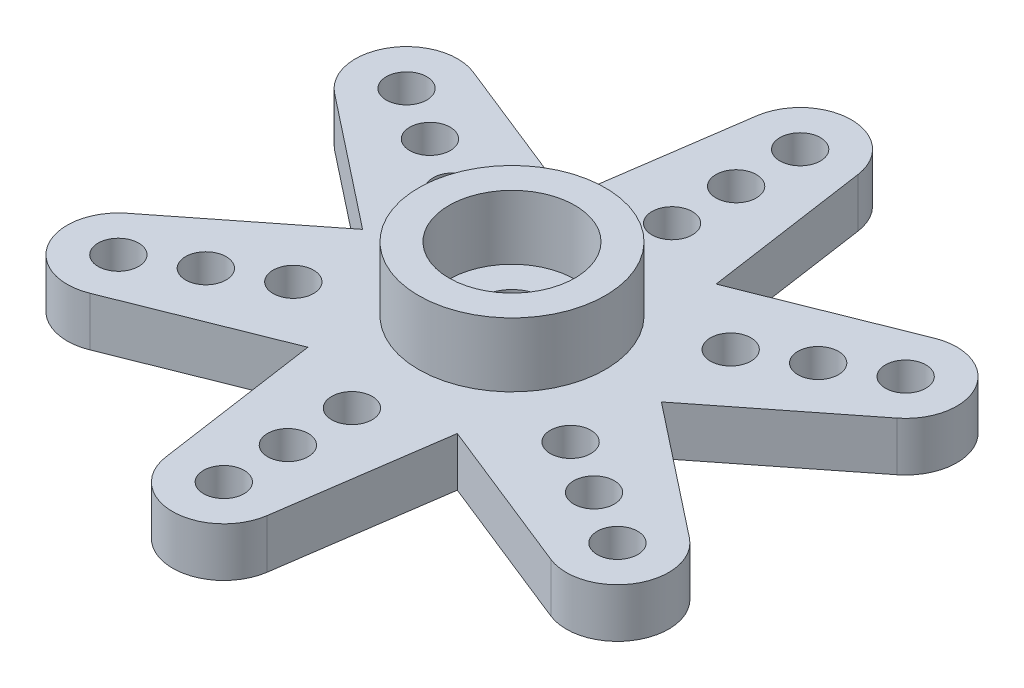
from build123d import *

# Parameters (mm, degrees)
CROQUIS1_R              = 0.95
CROQUIS1_R_2            = 1.5
SALIENTE_EXTRUIR1_DEPTH = 2.3
CROQUIS2_R              = 4.375
CROQUIS2_R_2            = 2.95
SALIENTE_EXTRUIR2_DEPTH = 3


with BuildPart() as part:
    # Croquis1 → Saliente-Extruir1 (new body)
    with BuildSketch(Plane(origin=(0, 0, 0), x_dir=(1, 0, 0), z_dir=(0, 1, 0))):
        with BuildLine():
            Line((-3.5, 6.062177826), (-2.375316078, 13.843327148))
            ThreePointArc((-2.375316078, 13.843327148), (0, 15.9), (2.375316078, 13.843327148))
            Line((2.375316078, 13.843327148), (3.5, 6.062177826))
            Line((3.5, 6.062177826), (10.801014944, 8.978747639))
            ThreePointArc((10.801014944, 8.978747639), (13.76980392, 7.95), (13.176331022, 4.864579508))
            Line((13.176331022, 4.864579508), (7, 0))
            Line((7, 0), (13.176331022, -4.864579508))
            ThreePointArc((13.176331022, -4.864579508), (13.76980392, -7.95), (10.801014944, -8.978747639))
            Line((10.801014944, -8.978747639), (3.5, -6.062177826))
            Line((3.5, -6.062177826), (2.375316078, -13.843327148))
            ThreePointArc((2.375316078, -13.843327148), (0, -15.9), (-2.375316078, -13.843327148))
            Line((-2.375316078, -13.843327148), (-3.5, -6.062177826))
            Line((-3.5, -6.062177826), (-10.801014944, -8.978747639))
            ThreePointArc((-10.801014944, -8.978747639), (-13.76980392, -7.95), (-13.176331022, -4.864579508))
            Line((-13.176331022, -4.864579508), (-7, 0))
            Line((-7, 0), (-13.176331022, 4.864579508))
            ThreePointArc((-13.176331022, 4.864579508), (-13.76980392, 7.95), (-10.801014944, 8.978747639))
            Line((-10.801014944, 8.978747639), (-3.5, 6.062177826))
        make_face()
        with Locations(Location((0, 13.5, 0), (0, 0, 270))):
            Circle(CROQUIS1_R, mode=Mode.SUBTRACT)
        with Locations(Location((0, 10.5, 0), (0, 0, 270))):
            Circle(CROQUIS1_R, mode=Mode.SUBTRACT)
        with Locations(Location((0, 7.5, 0), (0, 0, 270))):
            Circle(CROQUIS1_R, mode=Mode.SUBTRACT)
        with Locations(Location((11.691342951, 6.75, 0), (0, 0, 270))):
            Circle(CROQUIS1_R, mode=Mode.SUBTRACT)
        with Locations(Location((9.09326674, 5.25, 0), (0, 0, 270))):
            Circle(CROQUIS1_R, mode=Mode.SUBTRACT)
        with Locations(Location((6.495190528, 3.75, 0), (0, 0, 270))):
            Circle(CROQUIS1_R, mode=Mode.SUBTRACT)
        with Locations(Location((11.691342951, -6.75, 0), (0, 0, 270))):
            Circle(CROQUIS1_R, mode=Mode.SUBTRACT)
        with Locations(Location((9.09326674, -5.25, 0), (0, 0, 270))):
            Circle(CROQUIS1_R, mode=Mode.SUBTRACT)
        with Locations(Location((6.495190528, -3.75, 0), (0, 0, 270))):
            Circle(CROQUIS1_R, mode=Mode.SUBTRACT)
        with Locations(Location((0, -13.5, 0), (0, 0, 270))):
            Circle(CROQUIS1_R, mode=Mode.SUBTRACT)
        with Locations(Location((0, -10.5, 0), (0, 0, 270))):
            Circle(CROQUIS1_R, mode=Mode.SUBTRACT)
        with Locations(Location((0, -7.5, 0), (0, 0, 270))):
            Circle(CROQUIS1_R, mode=Mode.SUBTRACT)
        with Locations(Location((-11.691342951, -6.75, 0), (0, 0, 270))):
            Circle(CROQUIS1_R, mode=Mode.SUBTRACT)
        with Locations(Location((-9.09326674, -5.25, 0), (0, 0, 270))):
            Circle(CROQUIS1_R, mode=Mode.SUBTRACT)
        with Locations(Location((-6.495190528, -3.75, 0), (0, 0, 270))):
            Circle(CROQUIS1_R, mode=Mode.SUBTRACT)
        with Locations(Location((-11.691342951, 6.75, 0), (0, 0, 270))):
            Circle(CROQUIS1_R, mode=Mode.SUBTRACT)
        with Locations(Location((-9.09326674, 5.25, 0), (0, 0, 270))):
            Circle(CROQUIS1_R, mode=Mode.SUBTRACT)
        with Locations(Location((-6.495190528, 3.75, 0), (0, 0, 270))):
            Circle(CROQUIS1_R, mode=Mode.SUBTRACT)
        with Locations(Location((0, 0, 0), (0, 0, 270))):
            Circle(CROQUIS1_R_2, mode=Mode.SUBTRACT)
    extrude(amount=SALIENTE_EXTRUIR1_DEPTH)

    # Croquis2 → Saliente-Extruir2 (add)
    with BuildSketch(Plane(origin=(0, 2.3, 0), x_dir=(1, 0, 0), z_dir=(0, 1, 0))):
        with Locations(Location((0, 0, 0), (0, 0, 270))):
            Circle(CROQUIS2_R)
        with Locations(Location((0, 0, 0), (0, 0, 270))):
            Circle(CROQUIS2_R_2, mode=Mode.SUBTRACT)
    extrude(amount=SALIENTE_EXTRUIR2_DEPTH)


solid = part.part
